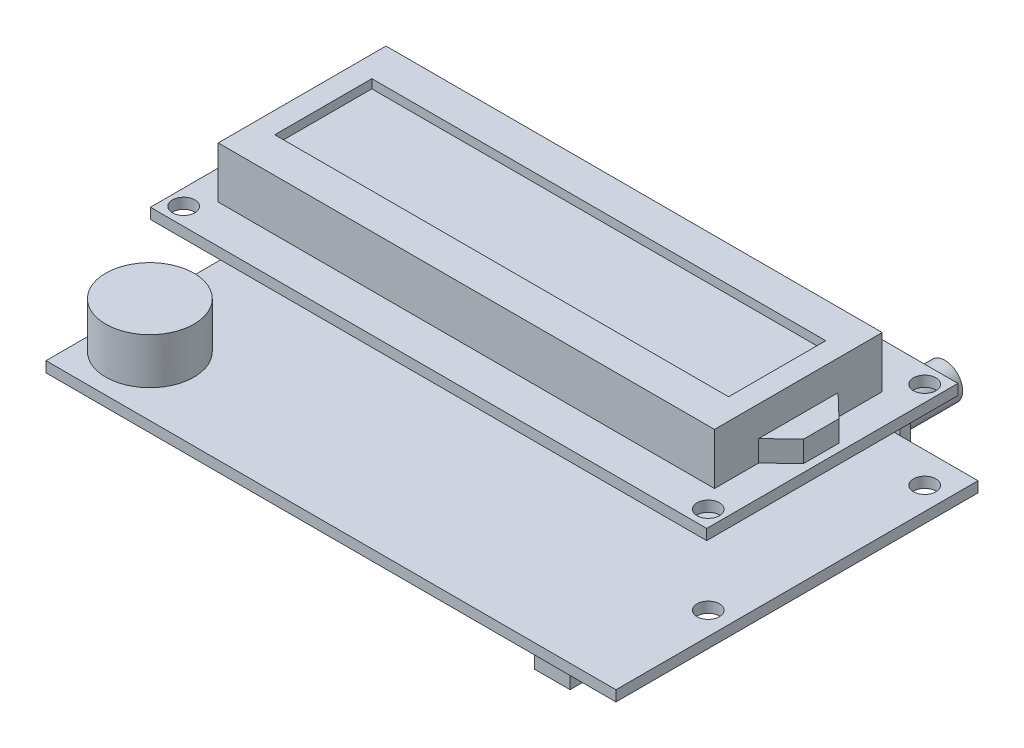
from build123d import *

# Parameters (mm, degrees)
SKETCH1_W            = 81.9785
SKETCH1_H            = 52.07
SKETCH1_R            = 1.6129
BASE_PCB_DEPTH       = 1.524
SKETCH2_W            = 6.35
SKETCH2_H            = 6.35
BOSS_EXTRUDE2_DEPTH  = 1.524
SKETCH3_R            = 2.54
BOSS_EXTRUDE3_DEPTH  = 8.128
SKETCH4_W            = 41.0972
SKETCH4_H            = 2.54
LCD_HEADER_DEPTH     = 11.0617
SKETCH5_W            = 80.01
SKETCH5_H            = 36.1315
SKETCH5_R            = 1.6129
LCD_PCB_DEPTH        = 1.524
SKETCH6_W            = 71.374
SKETCH6_H            = 24.13
BOSS_EXTRUDE6_DEPTH  = 7.366
SKETCH7_W            = 65.278
SKETCH7_H            = 13.97
CUT_EXTRUDE1_DEPTH   = 1.27
BOSS_EXTRUDE7_DEPTH  = 3.048
SKETCH9_R            = 6.35
BUZZER_DEPTH         = 6.604
SKETCH10_W           = 5.08
SKETCH10_H           = 17.78
BOSS_EXTRUDE9_DEPTH  = 2.54
SKETCH11_W           = 0.635
SKETCH11_H           = 0.635
BOSS_EXTRUDE10_DEPTH = 6.35
SKETCH12_W           = 5.08
SKETCH12_H           = 7.112
BOSS_EXTRUDE11_DEPTH = 2.54
SKETCH13_W           = 0.635
SKETCH13_H           = 0.635
BOSS_EXTRUDE12_DEPTH = 6.35


with BuildPart() as part:
    # Sketch1 → Base PCB (new body)
    with BuildSketch(Plane(origin=(0, 0, 0), x_dir=(1, 0, 0), z_dir=(0, 1, 0))):
        with Locations((40.98925, -26.035)):
            Rectangle(SKETCH1_W, SKETCH1_H)
        with Locations(Location((3.2639, -4.4069, 0), (0, 0, 90))):
            Circle(SKETCH1_R, mode=Mode.SUBTRACT)
        with Locations(Location((3.2639, -35.5346, 0), (0, 0, 90))):
            Circle(SKETCH1_R, mode=Mode.SUBTRACT)
        with Locations(Location((78.7146, -35.5346, 0), (0, 0, 90))):
            Circle(SKETCH1_R, mode=Mode.SUBTRACT)
        with Locations(Location((78.7146, -4.4069, 0), (0, 0, 90))):
            Circle(SKETCH1_R, mode=Mode.SUBTRACT)
    extrude(amount=BASE_PCB_DEPTH)

    # Sketch2 → Boss-Extrude2 (add)
    with BuildSketch(Plane(origin=(0, 0, 0), x_dir=(-1, 0, 0), z_dir=(0, 0, -1))):
        with Locations((-67.5767, 1.9558)):
            Rectangle(SKETCH2_W, SKETCH2_H)
    extrude(amount=BOSS_EXTRUDE2_DEPTH)

    # Sketch3 → Boss-Extrude3 (add)
    with BuildSketch(Plane(origin=(0, 0, -1.524), x_dir=(-1, 0, 0), z_dir=(0, 0, -1))):
        with Locations((-67.5767, 1.9558)):
            Circle(SKETCH3_R)
    extrude(amount=BOSS_EXTRUDE3_DEPTH)

    # Sketch4 → LCD Header (add)
    with BuildSketch(Plane(origin=(0, 1.524, 0), x_dir=(1, 0, 0), z_dir=(0, 1, 0))):
        with Locations((27.4701, -4.2545)):
            Rectangle(SKETCH4_W, SKETCH4_H)
    extrude(amount=LCD_HEADER_DEPTH)

    # Sketch5 → LCD PCB (add)
    with BuildSketch(Plane(origin=(0, 12.5857, 0), x_dir=(1, 0, 0), z_dir=(0, 1, 0))):
        with Locations((40.98925, -19.97075)):
            Rectangle(SKETCH5_W, SKETCH5_H)
        with Locations(Location((78.7146, -4.4069, 0), (0, 0, 90))):
            Circle(SKETCH5_R, mode=Mode.SUBTRACT)
        with Locations(Location((78.7146, -35.5346, 0), (0, 0, 90))):
            Circle(SKETCH5_R, mode=Mode.SUBTRACT)
        with Locations(Location((3.2639, -35.5346, 0), (0, 0, 90))):
            Circle(SKETCH5_R, mode=Mode.SUBTRACT)
        with Locations(Location((3.2639, -4.4069, 0), (0, 0, 90))):
            Circle(SKETCH5_R, mode=Mode.SUBTRACT)
    extrude(amount=LCD_PCB_DEPTH)

    # Sketch6 → Boss-Extrude6 (add)
    with BuildSketch(Plane(origin=(0, 14.1097, 0), x_dir=(1, 0, 0), z_dir=(0, 1, 0))):
        with Locations((40.90035, -20.447)):
            Rectangle(SKETCH6_W, SKETCH6_H)
    extrude(amount=BOSS_EXTRUDE6_DEPTH)

    # Sketch7 → Cut-Extrude1 (cut)
    with BuildSketch(Plane(origin=(0, 21.4757, 0), x_dir=(1, 0, 0), z_dir=(0, 1, 0))):
        with Locations((40.90035, -20.447)):
            Rectangle(SKETCH7_W, SKETCH7_H)
    extrude(amount=-CUT_EXTRUDE1_DEPTH, mode=Mode.SUBTRACT)

    # Sketch8 → Boss-Extrude7 (add)
    with BuildSketch(Plane(origin=(0, 14.1097, 0), x_dir=(1, 0, 0), z_dir=(0, 1, 0))):
        Polygon((76.58735, -14.732), (76.58735, -26.162), (79.88935, -22.987), (79.88935, -17.907), align=None)
    extrude(amount=BOSS_EXTRUDE7_DEPTH)

    # Sketch9 → Buzzer (add)
    with BuildSketch(Plane(origin=(0, 1.524, 0), x_dir=(1, 0, 0), z_dir=(0, 1, 0))):
        with Locations(Location((6.35, -43.4848, 0), (0, 0, 180))):
            Circle(SKETCH9_R)
    extrude(amount=BUZZER_DEPTH)

    # Sketch10 → Boss-Extrude9 (add)
    with BuildSketch(Plane.XZ):
        with Locations((72.0725, 42.418)):
            Rectangle(SKETCH10_W, SKETCH10_H)
    extrude(amount=BOSS_EXTRUDE9_DEPTH)

    # Sketch11 → Boss-Extrude10 (add)
    with BuildSketch(Plane.ZY.offset(-69.5325)):
        with Locations((37.592, -1.27)):
            Rectangle(SKETCH11_W, SKETCH11_H)
        with Locations((35.179, -1.27)):
            Rectangle(SKETCH11_W, SKETCH11_H)
        with Locations((40.005, -1.27)):
            Rectangle(SKETCH11_W, SKETCH11_H)
        with Locations((42.418, -1.27)):
            Rectangle(SKETCH11_W, SKETCH11_H)
        with Locations((44.831, -1.27)):
            Rectangle(SKETCH11_W, SKETCH11_H)
        with Locations((47.244, -1.27)):
            Rectangle(SKETCH11_W, SKETCH11_H)
        with Locations((49.657, -1.27)):
            Rectangle(SKETCH11_W, SKETCH11_H)
    extrude(amount=BOSS_EXTRUDE10_DEPTH)

    # Sketch12 → Boss-Extrude11 (add)
    with BuildSketch(Plane.XZ):
        with Locations((25.654, 39.37)):
            Rectangle(SKETCH12_W, SKETCH12_H)
    extrude(amount=BOSS_EXTRUDE11_DEPTH)

    # Sketch13 → Boss-Extrude12 (add)
    with BuildSketch(Plane(origin=(28.194, 0, 0), x_dir=(0, 0, -1), z_dir=(1, 0, 0))):
        with Locations((-39.37, -1.27)):
            Rectangle(SKETCH13_W, SKETCH13_H)
        with Locations((-41.783, -1.27)):
            Rectangle(SKETCH13_W, SKETCH13_H)
        with Locations((-36.957, -1.27)):
            Rectangle(SKETCH13_W, SKETCH13_H)
    extrude(amount=BOSS_EXTRUDE12_DEPTH)


solid = part.part
